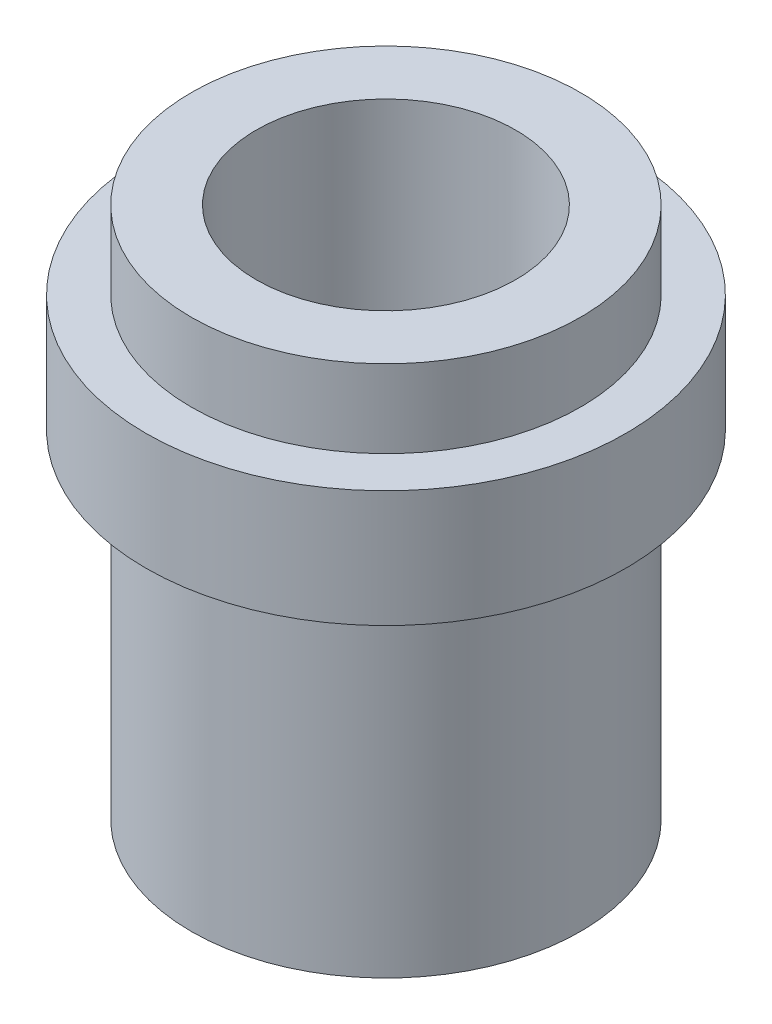
from build123d import *

# Parameters (mm, degrees)
SKETCH_2_R          = 10
CUT_EXTRUDE_1_DEPTH = 45


with BuildPart() as part:
    # Эскиз1 → Повернуть1 (revolve)
    with BuildSketch(Plane.XY, mode=Mode.PRIVATE) as revolve_1_sk:
        Polygon((0, 33.581413689), (15, 33.581413689), (15, 27.581413689), (18.5, 27.581413689), (18.5, 18.581413689), (15, 18.581413689), (15, -7.418586311), (0, -7.418586311), align=None)
    revolve(revolve_1_sk.sketch.rotate(Axis((0, 46.50337763, 0), (0, -1, 0)), 90), axis=Axis((0, 46.50337763, 0), (0, -1, 0)))

    # Эскиз2 → Вырез-Вытянуть1 (cut)
    with BuildSketch(Plane(origin=(0, 33.581413689, 0), x_dir=(1, 0, 0), z_dir=(0, 1, 0))):
        with Locations(Location((0, 0, 0), (0, 0, 270))):
            Circle(SKETCH_2_R)
    extrude(amount=-CUT_EXTRUDE_1_DEPTH, mode=Mode.SUBTRACT)


solid = part.part
